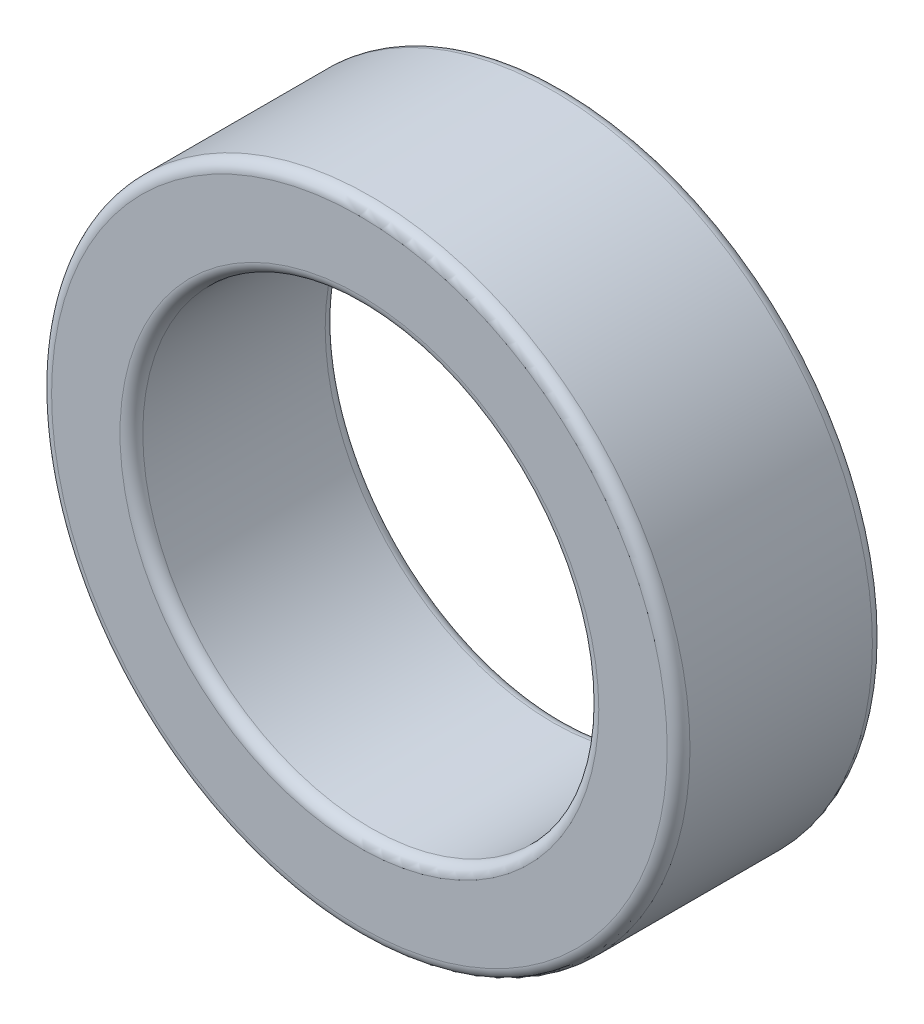
from build123d import *

# Parameters (mm, degrees)
SKETCH1_R           = 7
SKETCH1_R_2         = 5
BOSS_EXTRUDE1_DEPTH = 2.25
FILLET1_R           = 0.25


with BuildPart() as part:
    # Sketch1 → Boss-Extrude1 (new, symmetric)
    with BuildSketch(Plane.XY):
        Circle(SKETCH1_R)
        Circle(SKETCH1_R_2, mode=Mode.SUBTRACT)
    extrude(amount=BOSS_EXTRUDE1_DEPTH, both=True)

    # Fillet1
    fillet1_edges = [part.edges().sort_by_distance(p)[0] for p in [
        (-7, 0, -2.25),
        (-7, 0, 2.25),
        (-5, 0, -2.25),
        (-5, 0, 2.25),
    ]]
    fillet(fillet1_edges, radius=FILLET1_R)


solid = part.part
